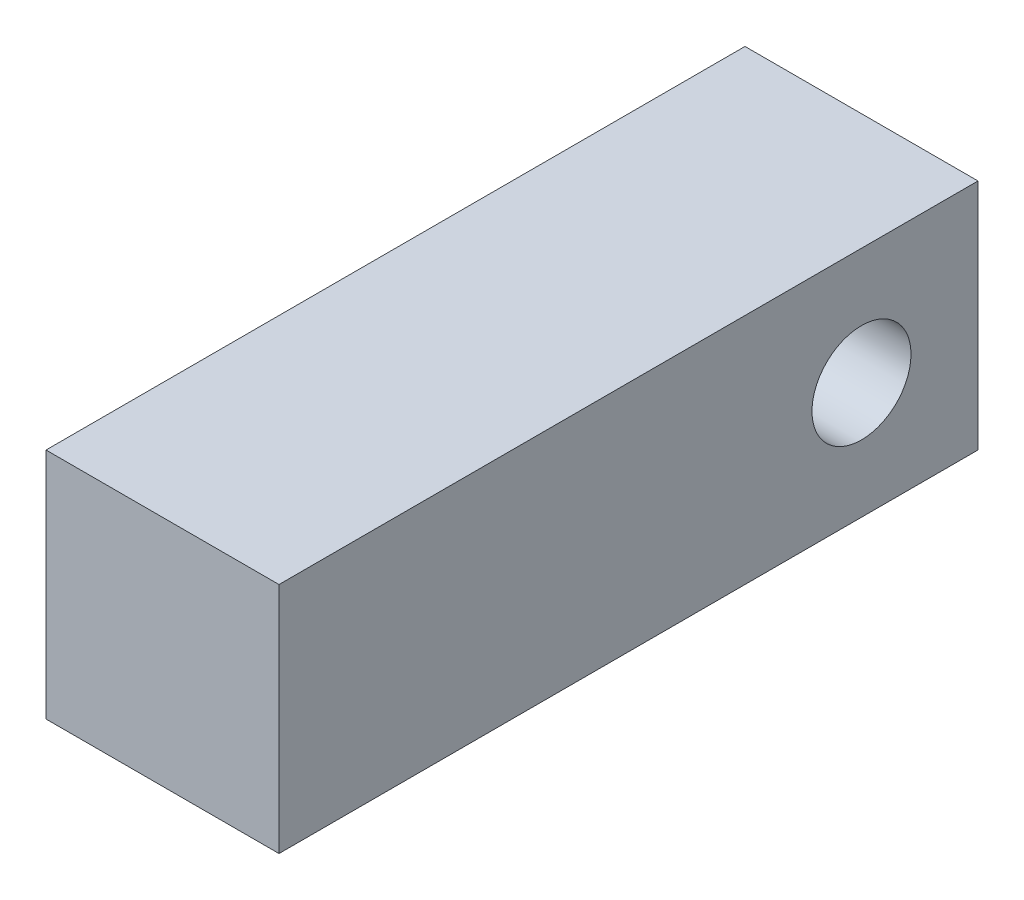
from build123d import *

# Parameters (mm, degrees)
SKETCH1_W           = 152.4
SKETCH1_H           = 50.8
BOSS_EXTRUDE1_DEPTH = 50.8
SKETCH2_R           = 10.795
CUT_EXTRUDE1_DEPTH  = 169.48453935


with BuildPart() as part:
    # Sketch1 → Boss-Extrude1 (new body)
    with BuildSketch(Plane(origin=(0, 0, 0), x_dir=(0, 0, -1), z_dir=(1, 0, 0))):
        with Locations((76.2, 25.4)):
            Rectangle(SKETCH1_W, SKETCH1_H)
    extrude(amount=BOSS_EXTRUDE1_DEPTH)

    # Sketch2 → Cut-Extrude1 (cut, through all)
    with BuildSketch(Plane(origin=(50.8, 0, 0), x_dir=(0, 0, -1), z_dir=(1, 0, 0))):
        with Locations((127, 25.4)):
            Circle(SKETCH2_R)
    extrude(amount=-CUT_EXTRUDE1_DEPTH, mode=Mode.SUBTRACT)


solid = part.part
